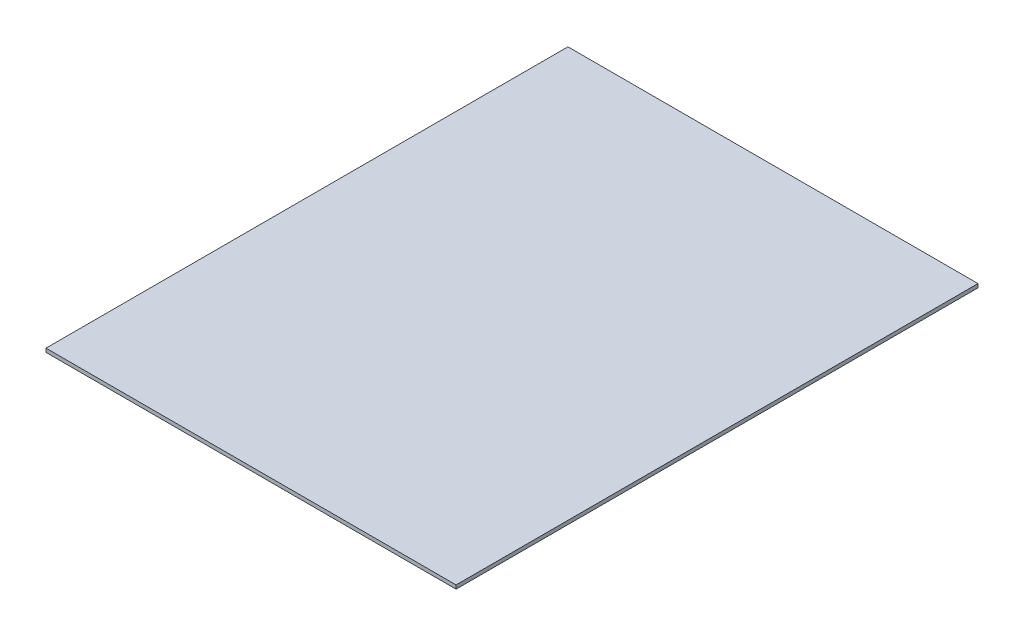
from build123d import *

# Parameters (mm, degrees)
SKETCH1_W           = 550
SKETCH1_H           = 700
BOSS_EXTRUDE1_DEPTH = 5


with BuildPart() as part:
    # Sketch1 → Boss-Extrude1 (new body)
    with BuildSketch(Plane(origin=(0, 0, 0), x_dir=(1, 0, 0), z_dir=(0, 1, 0))):
        with Locations((-275, -350)):
            Rectangle(SKETCH1_W, SKETCH1_H)
    extrude(amount=BOSS_EXTRUDE1_DEPTH)


solid = part.part
